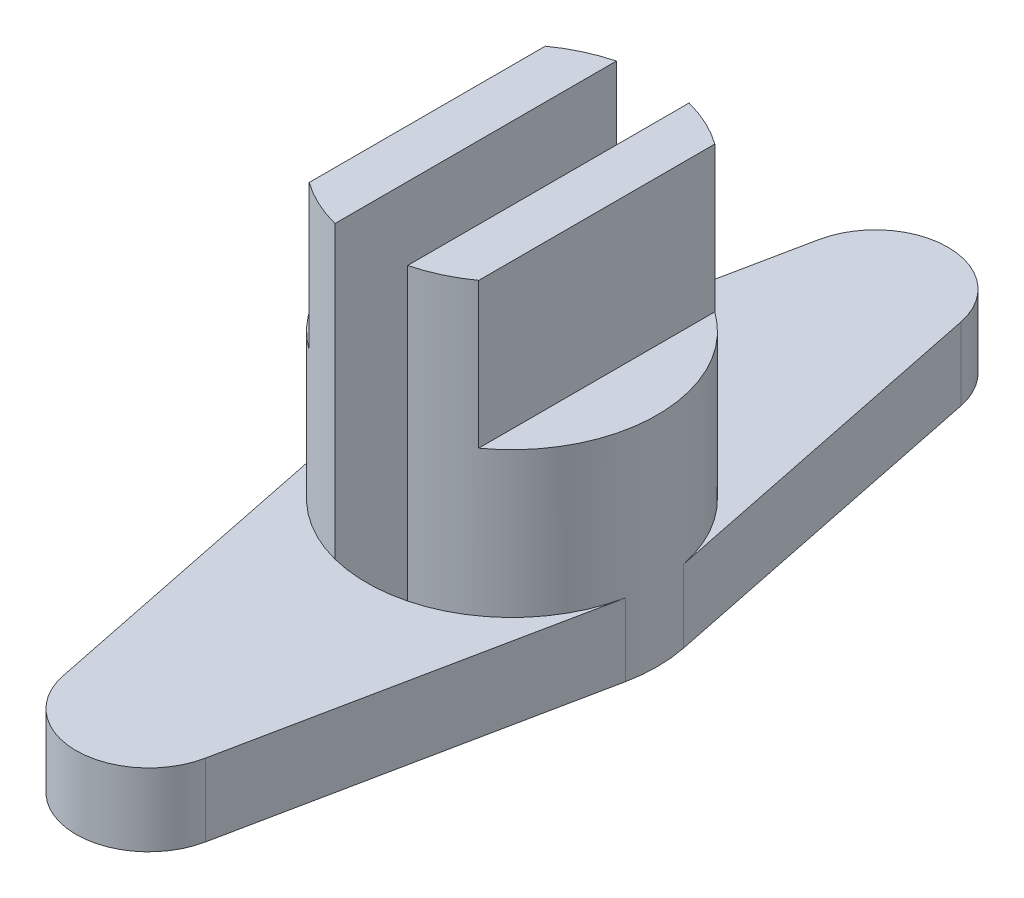
from build123d import *
from build123d.topology import SkipClean

# Parameters (mm, degrees)
BOSS_EXTRUDE1_DEPTH = 15
SKETCH2_R           = 30
BOSS_EXTRUDE2_DEPTH = 60
CUT_EXTRUDE1_DEPTH  = 121.933866224
CUT_EXTRUDE2_START  = -30
CUT_EXTRUDE2_DEPTH  = 30


with BuildPart() as part:
    # Sketch1 → Boss-Extrude1 (new body)
    with BuildSketch(Plane(origin=(0, 0, 0), x_dir=(1, 0, 0), z_dir=(0, 1, 0))):
        with BuildLine():
            Line((-14.696938457, 78), (-29.393876913, 6))
            ThreePointArc((-29.393876913, 6), (-30, 0), (-29.393876913, -6))
            Line((-29.393876913, -6), (-14.696938457, -78))
            ThreePointArc((-14.696938457, -78), (0, -90), (14.696938457, -78))
            Line((14.696938457, -78), (29.393876913, -6))
            ThreePointArc((29.393876913, -6), (30, 0), (29.393876913, 6))
            Line((29.393876913, 6), (14.696938457, 78))
            ThreePointArc((14.696938457, 78), (0, 90), (-14.696938457, 78))
        make_face()
    extrude(amount=BOSS_EXTRUDE1_DEPTH)

    # Sketch2 → Boss-Extrude2 (add)
    with BuildSketch(Plane(origin=(0, 15, 0), x_dir=(1, 0, 0), z_dir=(0, 1, 0))):
        with Locations(Location((0, 0, 0), (0, 0, 11.536959033))):
            Circle(SKETCH2_R)
    extrude(amount=BOSS_EXTRUDE2_DEPTH)

    # Sketch3 → Cut-Extrude1 (cut, through all)
    with SkipClean():  # the faces are left unmerged after this step: merging them gives an invalid solid
        with BuildSketch(Plane(origin=(0, 75, 0), x_dir=(1, 0, 0), z_dir=(0, 1, 0))):
            with BuildLine():
                Line((-7.5, 29.047375097), (-7.5, -29.047375097))
                ThreePointArc((-7.5, -29.047375097), (0, -30), (7.5, -29.047375097))
                Line((7.5, -29.047375097), (7.5, 29.047375097))
                ThreePointArc((7.5, 29.047375097), (0, 30), (-7.5, 29.047375097))
            make_face()
        extrude(amount=-CUT_EXTRUDE1_DEPTH, mode=Mode.SUBTRACT)

    # Sketch4 → Cut-Extrude2 (cut)
    with SkipClean():  # the faces are left unmerged after this step: merging them gives an invalid solid
        with BuildSketch(Plane(origin=(0, 75, 0), x_dir=(1, 0, 0), z_dir=(0, 1, 0)).offset(CUT_EXTRUDE2_START)):
            with BuildLine():
                Line((-17.5, 24.366985862), (-17.5, -24.366985862))
                ThreePointArc((-17.5, -24.366985862), (-30, 0), (-17.5, 24.366985862))
            make_face()
            with BuildLine():
                Line((17.5, -24.366985862), (17.5, 24.366985862))
                ThreePointArc((17.5, 24.366985862), (30, 0), (17.5, -24.366985862))
            make_face()
        extrude(amount=CUT_EXTRUDE2_DEPTH, mode=Mode.SUBTRACT)


solid = part.part
